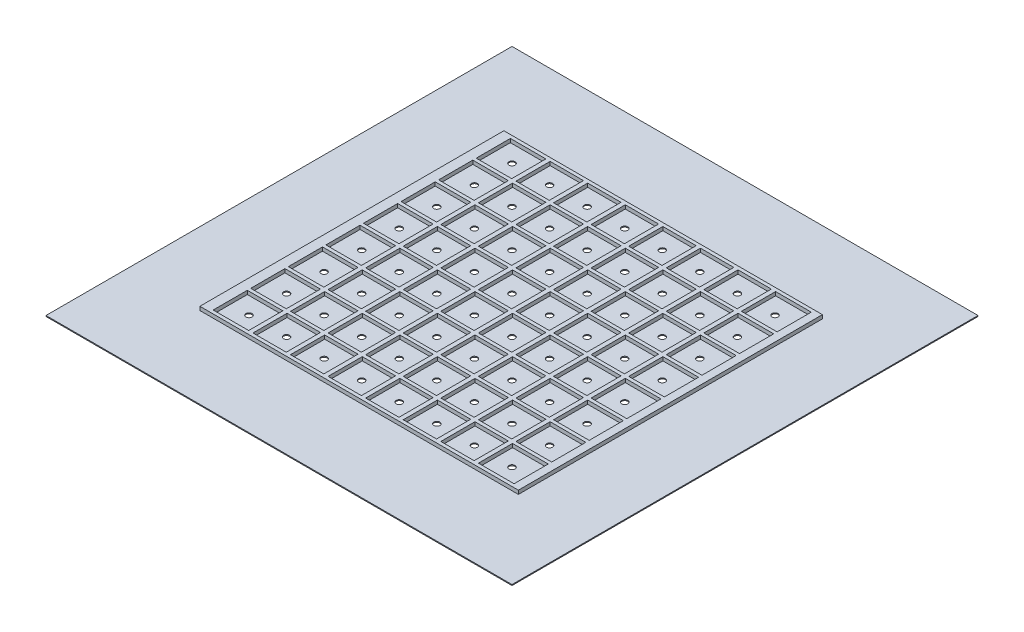
from build123d import *

# Parameters (mm, degrees)
SKETCH1_W            = 630
SKETCH1_H            = 630
BOSS_EXTRUDE1_DEPTH  = 1.242561379
SKETCH6_R            = 4.1
CUT_EXTRUDE1_DEPTH   = 446.479005071
LPATTERN1_COUNT      = 8
LPATTERN1_PITCH      = 50.8
LPATTERN1_COUNT_DIR2 = 8
LPATTERN1_PITCH_DIR2 = 50.8
SKETCH7_W            = 406.797285726
SKETCH7_H            = 4.6
BOSS_EXTRUDE4_DEPTH  = 5
LPATTERN3_COUNT      = 8
LPATTERN3_PITCH      = 50.8
LPATTERN3_COL_COUNT  = 2
LPATTERN3_COL_PITCH  = 50.8
SKETCH9_W            = 13.359654339
SKETCH9_H            = 411
SKETCH9_W_2          = 10.433350796
BOSS_EXTRUDE5_DEPTH  = 5
SKETCH10_W           = 5.777909053
SKETCH10_H           = 46.2
BOSS_EXTRUDE6_DEPTH  = 5
LPATTERN4_COUNT      = 7
LPATTERN4_PITCH      = 50.8
LPATTERN4_COUNT_DIR2 = 8
LPATTERN4_PITCH_DIR2 = 50.8


with BuildPart() as part:
    # Sketch1 → Boss-Extrude1 (new body)
    with BuildSketch(Plane(origin=(0, 0, 0), x_dir=(1, 0, 0), z_dir=(0, 1, 0))):
        Rectangle(SKETCH1_W, SKETCH1_H)
    extrude(amount=BOSS_EXTRUDE1_DEPTH)

    # Sketch6 → Cut-Extrude1 (cut, through all)
    with BuildSketch(Plane(origin=(0, 1.242561379, 0), x_dir=(1, 0, 0), z_dir=(0, 1, 0))):
        with Locations(Location((-178, 178, 0), (0, 0, 270))):
            Circle(SKETCH6_R)
    cut_extrude1 = extrude(amount=-CUT_EXTRUDE1_DEPTH, mode=Mode.SUBTRACT)

    # LPattern1: Cut-Extrude1 8 × 8
    with Locations(*[(i * LPATTERN1_PITCH, 0, j * LPATTERN1_PITCH_DIR2) for i in range(LPATTERN1_COUNT) for j in range(LPATTERN1_COUNT_DIR2) if (i, j) != (0, 0)]):
        add(cut_extrude1, mode=Mode.SUBTRACT)

    # Sketch7 → Boss-Extrude4 (add)
    with BuildSketch(Plane(origin=(0, 1.242561379, 0), x_dir=(1, 0, 0), z_dir=(0, 1, 0))):
        with Locations((0.009206197, 152.685017551)):
            Rectangle(SKETCH7_W, SKETCH7_H)
    boss_extrude4 = extrude(amount=BOSS_EXTRUDE4_DEPTH)

    # LPattern3: Boss-Extrude4 ×8
    with Locations(*[(0, 0, i * LPATTERN3_PITCH) for i in range(1, LPATTERN3_COUNT)]):
        add(boss_extrude4)

    # LPattern3 col: Boss-Extrude4 ×2
    with Locations(*[(0, 0, -i * LPATTERN3_COL_PITCH) for i in range(1, LPATTERN3_COL_COUNT)]):
        add(boss_extrude4)

    # Sketch9 → Boss-Extrude5 (add)
    with BuildSketch(Plane(origin=(0, 1.242561379, 0), x_dir=(1, 0, 0), z_dir=(0, 1, 0))):
        with Locations((-210.069263836, 0.285017551)):
            Rectangle(SKETCH9_W, SKETCH9_H)
        with Locations((208.624524458, 0.285017551)):
            Rectangle(SKETCH9_W_2, SKETCH9_H)
    extrude(amount=BOSS_EXTRUDE5_DEPTH)

    # Sketch10 → Boss-Extrude6 (add)
    with BuildSketch(Plane(origin=(0, 1.242561379, 0), x_dir=(1, 0, 0), z_dir=(0, 1, 0))):
        with Locations((-152.512409354, 178.085017551)):
            Rectangle(SKETCH10_W, SKETCH10_H)
    boss_extrude6 = extrude(amount=BOSS_EXTRUDE6_DEPTH)

    # LPattern4: Boss-Extrude6 7 × 8
    with Locations(*[(i * LPATTERN4_PITCH, 0, j * LPATTERN4_PITCH_DIR2) for i in range(LPATTERN4_COUNT) for j in range(LPATTERN4_COUNT_DIR2) if (i, j) != (0, 0)]):
        add(boss_extrude6)


solid = part.part
